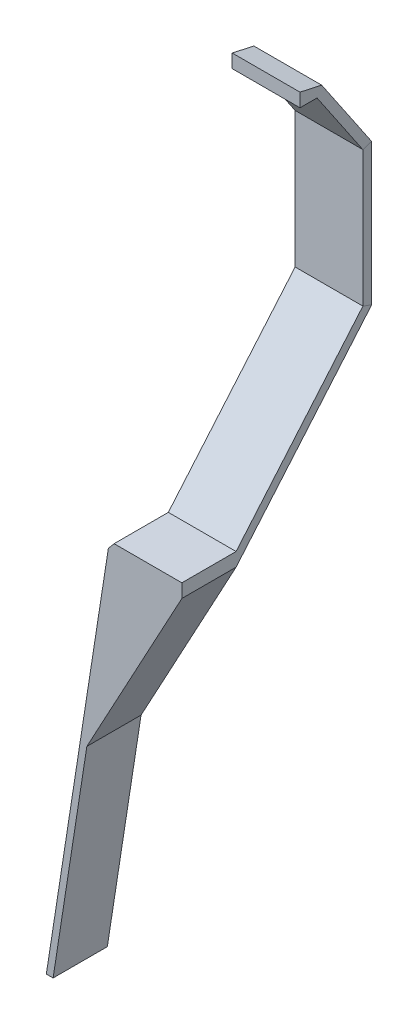
from build123d import *

# Parameters (mm, degrees)
SKETCH_9_W          = 32
SKETCH_9_H          = 240
EXTRUDE_4_DEPTH     = 8
EXTRUDE_5_DEPTH     = 32
SKETCH_11_W         = 40
SKETCH_11_H         = 8
EXTRUDE_6_DEPTH     = 40
SKETCH_14_W         = 4
SKETCH_14_H         = 32
SKETCH_16_W         = 49.074899356
SKETCH_16_H         = 238.21753212
CUT_EXTRUDE_1_DEPTH = 40
EXTRUDE_7_DEPTH     = 32


with BuildPart() as part:
    # 草图9 → 凸台-拉伸4 (new body)
    with BuildSketch(Plane(origin=(0, 0, 0), x_dir=(0, 0, -1), z_dir=(1, 0, 0))):
        with Locations((0, 120)):
            Rectangle(SKETCH_9_W, SKETCH_9_H)
    extrude(amount=EXTRUDE_4_DEPTH)

    # 草图10 → 凸台-拉伸5 (add)
    with BuildSketch(Plane.XY.offset(16)):
        Polygon((40, 232), (8, 120), (8, 232), (8, 240), (40, 240), align=None)
    extrude(amount=-EXTRUDE_5_DEPTH)

    # 扫描8: sweep along a path in 草图12
    with BuildLine(Plane.ZY) as sweep_8_path:
        Line((-16, 240), (-90.839227599, 328))
        Line((-90.839227599, 328), (-90.839227599, 408))
        Line((-90.839227599, 408), (-63.750419078, 447.942286341))
        Line((-63.750419078, 447.942286341), (-53.704847623, 447.942286341))
    # 草图11 → 扫描8 (sweep)
    with BuildSketch(Plane(origin=(0, 0, -16), x_dir=(-1, 0, 0), z_dir=(0, 0, -1))):
        with Locations((-20, 236)):
            Rectangle(SKETCH_11_W, SKETCH_11_H)
    sweep(path=sweep_8_path.line, transition=Transition.RIGHT)

    # 草图13 → 凸台-拉伸6 (add)
    with BuildSketch(Plane.ZY):
        Polygon((-66.49773312, 453.125050648), (-53.704847623, 455.942286341), (-53.704847623, 447.942286341), (-63.750419078, 447.942286341), align=None)
    extrude(amount=-EXTRUDE_6_DEPTH)

    # 扫描9: sweep along a path in 草图15
    with BuildLine(Plane.XY.offset(16)) as sweep_9_path:
        Line((-36, 0), (0, 232))
        Line((0, 232), (40, 232))
    # 草图14 → 扫描9 (sweep)
    with BuildSketch(Plane.XZ):
        with Locations((-38, 0)):
            Rectangle(SKETCH_14_W, SKETCH_14_H)
    sweep(path=sweep_9_path.line, transition=Transition.RIGHT)

    # 草图16 → 切除-拉伸1 (cut)
    with BuildSketch(Plane.XY.offset(16)):
        with Locations((24.537449678, 112.89123394)):
            Rectangle(SKETCH_16_W, SKETCH_16_H)
    extrude(amount=-CUT_EXTRUDE_1_DEPTH, mode=Mode.SUBTRACT)

    # 草图17 → 凸台-拉伸7 (add)
    with BuildSketch(Plane.XY.offset(16)):
        Polygon((-3.386650681, 235.952695613), (0, 240), (40, 240), (40, 232), (-21.69332534, 117.976347807), align=None)
    extrude(amount=-EXTRUDE_7_DEPTH)


solid = part.part
